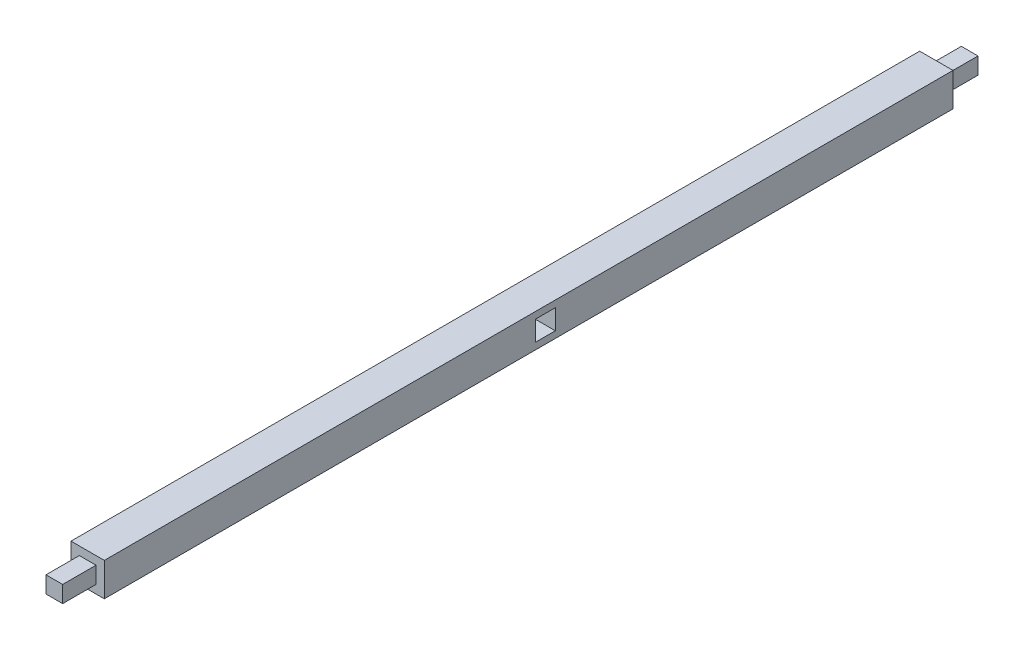
from build123d import *

# Parameters (mm, degrees)
SKETCH1_W           = 5
SKETCH1_H           = 5
BOSS_EXTRUDE1_DEPTH = 127.3
SKETCH2_W           = 2.5
SKETCH2_H           = 2.5
BOSS_EXTRUDE2_DEPTH = 5
SKETCH3_W           = 2.5
SKETCH3_H           = 2.5
BOSS_EXTRUDE3_DEPTH = 5
SKETCH4_W           = 3
SKETCH4_H           = 3
CUT_EXTRUDE1_DEPTH  = 30


with BuildPart() as part:
    # Sketch1 → Boss-Extrude1 (new body)
    with BuildSketch(Plane.XY):
        with Locations((2.5, 2.5)):
            Rectangle(SKETCH1_W, SKETCH1_H)
    extrude(amount=BOSS_EXTRUDE1_DEPTH)

    # Sketch2 → Boss-Extrude2 (add)
    with BuildSketch(Plane(origin=(0, 0, 0), x_dir=(-1, 0, 0), z_dir=(0, 0, -1))):
        with Locations((-2.5, 2.5)):
            Rectangle(SKETCH2_W, SKETCH2_H)
    extrude(amount=BOSS_EXTRUDE2_DEPTH)

    # Sketch3 → Boss-Extrude3 (add)
    with BuildSketch(Plane.XY.offset(127.3)):
        with Locations((2.5, 2.5)):
            Rectangle(SKETCH3_W, SKETCH3_H)
    extrude(amount=BOSS_EXTRUDE3_DEPTH)

    # Sketch4 → Cut-Extrude1 (cut)
    with BuildSketch(Plane.ZY):
        with Locations((61.15, 2.5)):
            Rectangle(SKETCH4_W, SKETCH4_H)
    extrude(amount=-CUT_EXTRUDE1_DEPTH, mode=Mode.SUBTRACT)


solid = part.part
